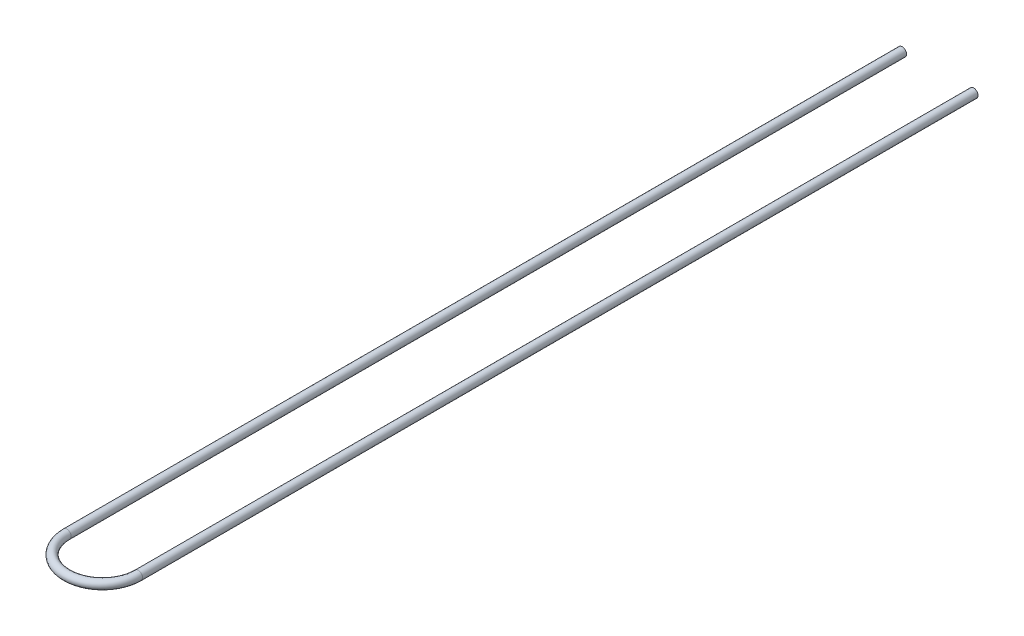
from build123d import *

# Parameters (mm, degrees)
SKETCH2_R   = 11.1
SKETCH2_R_2 = 9.95


with BuildPart() as part:
    # Sweep1: sweep along a path in Sketch1
    with BuildLine(Plane(origin=(0, 0, 0), x_dir=(1, 0, 0), z_dir=(0, 1, 0))) as sweep1_path:
        Line((143.08, -300), (143.08, -2440))
        ThreePointArc((143.08, -2440), (51.54, -2531.54), (-40, -2440))
        Line((-40, -2440), (-40, -300))
    # Sketch2 → Sweep1 (sweep)
    with BuildSketch(Plane(origin=(143.08, 0, 300), x_dir=(-1, 0, 0), z_dir=(0, 0, -1))):
        Circle(SKETCH2_R)
        Circle(SKETCH2_R_2, mode=Mode.SUBTRACT)
    sweep(path=sweep1_path.line)


solid = part.part
